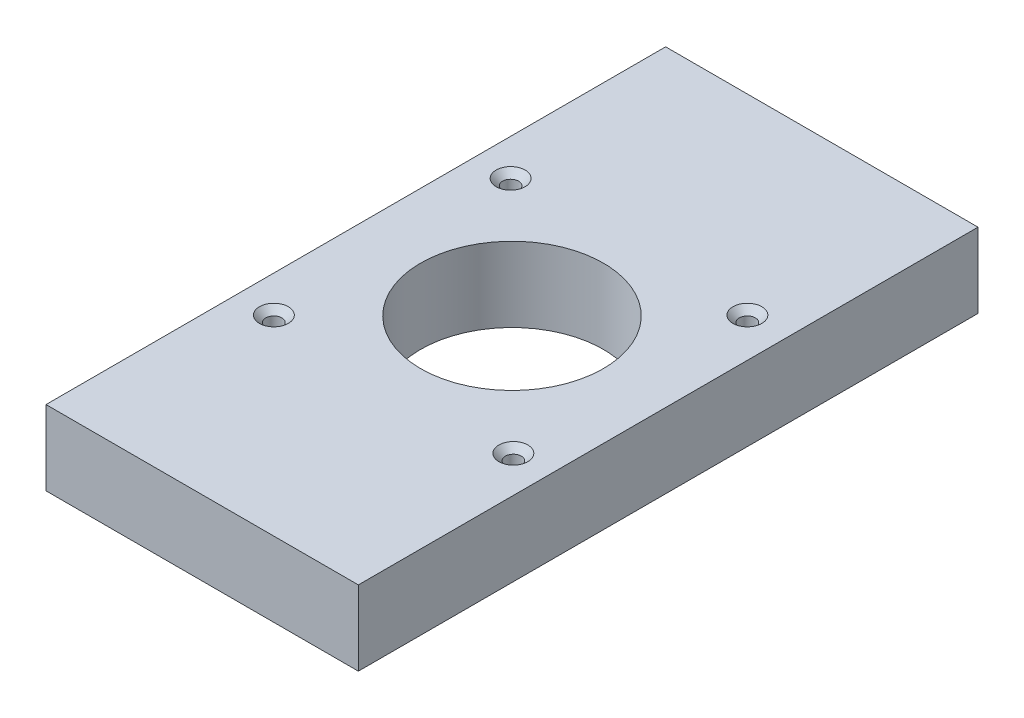
from build123d import *

# Parameters (mm, degrees)
SKETCH1_W                                = 30.83052
SKETCH1_H                                = 61.15812
BOSS_EXTRUDE1_DEPTH                      = 7.37616
SKETCH2_R                                = 9.02208
CUT_EXTRUDE1_DEPTH                       = 36.030228199
F_1_16_0_0625_DIAMETER_HOLE2_D           = 1.5875
F_1_16_0_0625_DIAMETER_HOLE2_CSINK_D     = 2.8575
F_1_16_0_0625_DIAMETER_HOLE2_CSINK_ANGLE = 90


with BuildPart() as part:
    # Sketch1 → Boss-Extrude1 (new body)
    with BuildSketch(Plane(origin=(0, 0, 0), x_dir=(1, 0, 0), z_dir=(0, 1, 0))):
        Rectangle(SKETCH1_W, SKETCH1_H)
    extrude(amount=BOSS_EXTRUDE1_DEPTH)

    # Sketch2 → Cut-Extrude1 (cut, through all)
    with BuildSketch(Plane(origin=(0, 7.37616, 0), x_dir=(1, 0, 0), z_dir=(0, 1, 0))):
        with Locations(Location((0, 0, 0), (0, 0, 270))):
            Circle(SKETCH2_R)
    extrude(amount=-CUT_EXTRUDE1_DEPTH, mode=Mode.SUBTRACT)

    # 1/16 (0.0625) Diameter Hole2 (through all)
    with Locations(Plane(origin=(0, 7.37616, 0), x_dir=(1, 0, 0), z_dir=(0, 1, 0))):
        with Locations((-11.81862, 11.684), (11.54938, 11.684), (11.81862, -11.684), (-11.81862, -11.684)):
            CounterSinkHole(F_1_16_0_0625_DIAMETER_HOLE2_D / 2, F_1_16_0_0625_DIAMETER_HOLE2_CSINK_D / 2, counter_sink_angle=F_1_16_0_0625_DIAMETER_HOLE2_CSINK_ANGLE)


solid = part.part
